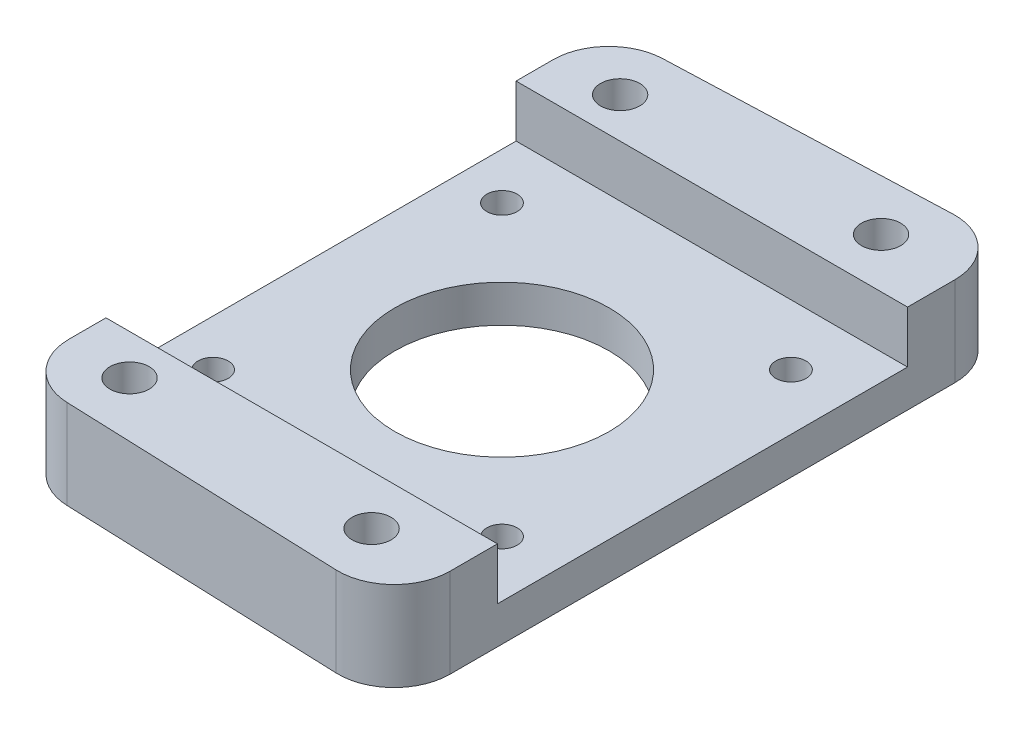
from build123d import *

# Parameters (mm, degrees)
BOSS_EXTRUDE1_DEPTH = 4
SKETCH3_R           = 11.5
CUT_EXTRUDE1_DEPTH  = 40.855495589
SKETCH4_R           = 1.625
CUT_EXTRUDE2_DEPTH  = 40.855495589
BOSS_EXTRUDE2_DEPTH = 5.575
SKETCH7_R           = 2.1
CUT_EXTRUDE3_DEPTH  = 6
FILLET1_R           = 6


with BuildPart() as part:
    # Sketch1 → Boss-Extrude1 (new body)
    with BuildSketch(Plane(origin=(0, 0, 0), x_dir=(1, 0, 0), z_dir=(0, 1, 0))):
        Polygon((21.510162675, -33.313262079), (-20.489837325, -31.733061767), (-20.489837325, 31.733061767), (21.510162675, 33.313262079), align=None)
    extrude(amount=BOSS_EXTRUDE1_DEPTH)

    # Sketch3 → Cut-Extrude1 (cut, through all)
    with BuildSketch(Plane(origin=(0, 4, 0), x_dir=(1, 0, 0), z_dir=(0, 1, 0))):
        with Locations(Location((0, 0, 0), (0, 0, 270))):
            Circle(SKETCH3_R)
    extrude(amount=-CUT_EXTRUDE1_DEPTH, mode=Mode.SUBTRACT)

    # Sketch4 → Cut-Extrude2 (cut, through all)
    with BuildSketch(Plane(origin=(0, 4, 0), x_dir=(1, 0, 0), z_dir=(0, 1, 0))):
        with Locations(Location((-15.5, 15.5, 0), (0, 0, 270))):
            Circle(SKETCH4_R)
        with Locations(Location((15.5, 15.5, 0), (0, 0, 270))):
            Circle(SKETCH4_R)
        with Locations(Location((15.5, -15.5, 0), (0, 0, 270))):
            Circle(SKETCH4_R)
        with Locations(Location((-15.5, -15.5, 0), (0, 0, 270))):
            Circle(SKETCH4_R)
    extrude(amount=-CUT_EXTRUDE2_DEPTH, mode=Mode.SUBTRACT)

    # Sketch6 → Boss-Extrude2 (add)
    with BuildSketch(Plane.XZ.offset(-4)):
        Polygon((-20.489837325, 22), (-20.489837325, 31.733061767), (21.510162675, 33.313262079), (21.510162675, 22), align=None)
    boss_extrude2 = extrude(amount=-BOSS_EXTRUDE2_DEPTH)

    # Mirror1: Boss-Extrude2 across plane
    add(boss_extrude2.mirror(Plane.XY))

    # Sketch7 → Cut-Extrude3 (cut)
    with BuildSketch(Plane(origin=(0, 9.575, 0), x_dir=(1, 0, 0), z_dir=(0, 1, 0))):
        with Locations(Location((13.340455159, 27.331724457, 0), (0, 0, 270))):
            Circle(SKETCH7_R)
        with Locations(Location((-13.640455159, 26.316599626, 0), (0, 0, 270))):
            Circle(SKETCH7_R)
        with Locations(Location((-13.640455159, -26.316599626, 0), (0, 0, 270))):
            Circle(SKETCH7_R)
        with Locations(Location((13.340455159, -27.331724457, 0), (0, 0, 270))):
            Circle(SKETCH7_R)
    extrude(amount=-CUT_EXTRUDE3_DEPTH, mode=Mode.SUBTRACT)

    # Fillet1
    fillet1_edges = [part.edges().sort_by_distance(p)[0] for p in [
        (-20.489837325, 4.7875, -31.733061767),
        (21.510162675, 4.7875, -33.313262079),
        (21.510162675, 4.7875, 33.313262079),
        (-20.489837325, 4.7875, 31.733061767),
    ]]
    fillet(fillet1_edges, radius=FILLET1_R)


solid = part.part
